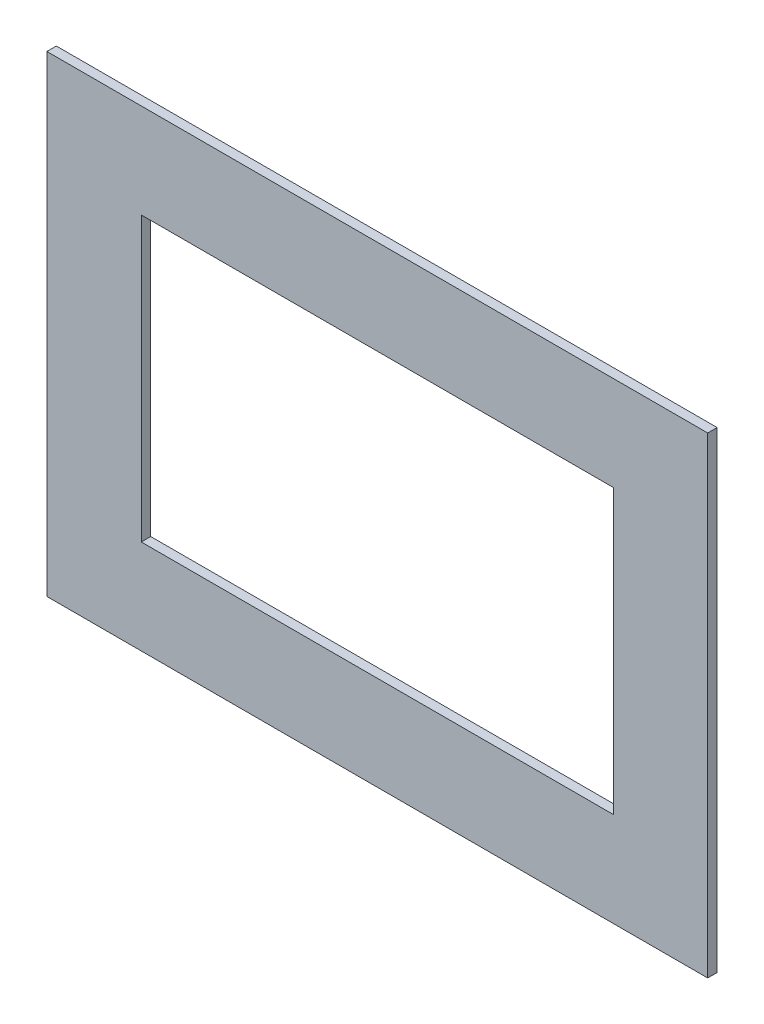
from build123d import *

# Parameters (mm, degrees)
ESQUISSE1_W             = 700
ESQUISSE1_H             = 500
BOSS_EXTRU_1_DEPTH      = 10
ESQUISSE2_W             = 500
ESQUISSE2_H             = 300
ENL_V_MAT_EXTRU_1_DEPTH = 10


with BuildPart() as part:
    # Esquisse1 → Boss.-Extru.1 (new body)
    with BuildSketch(Plane.XY):
        with Locations((-350, 250)):
            Rectangle(ESQUISSE1_W, ESQUISSE1_H)
    extrude(amount=BOSS_EXTRU_1_DEPTH)

    # Esquisse2 → Enlèv. mat.-Extru.1 (cut)
    with BuildSketch(Plane(origin=(0, 0, 0), x_dir=(-1, 0, 0), z_dir=(0, 0, -1))):
        with Locations((350, 250)):
            Rectangle(ESQUISSE2_W, ESQUISSE2_H)
    extrude(amount=-ENL_V_MAT_EXTRU_1_DEPTH, mode=Mode.SUBTRACT)


solid = part.part
